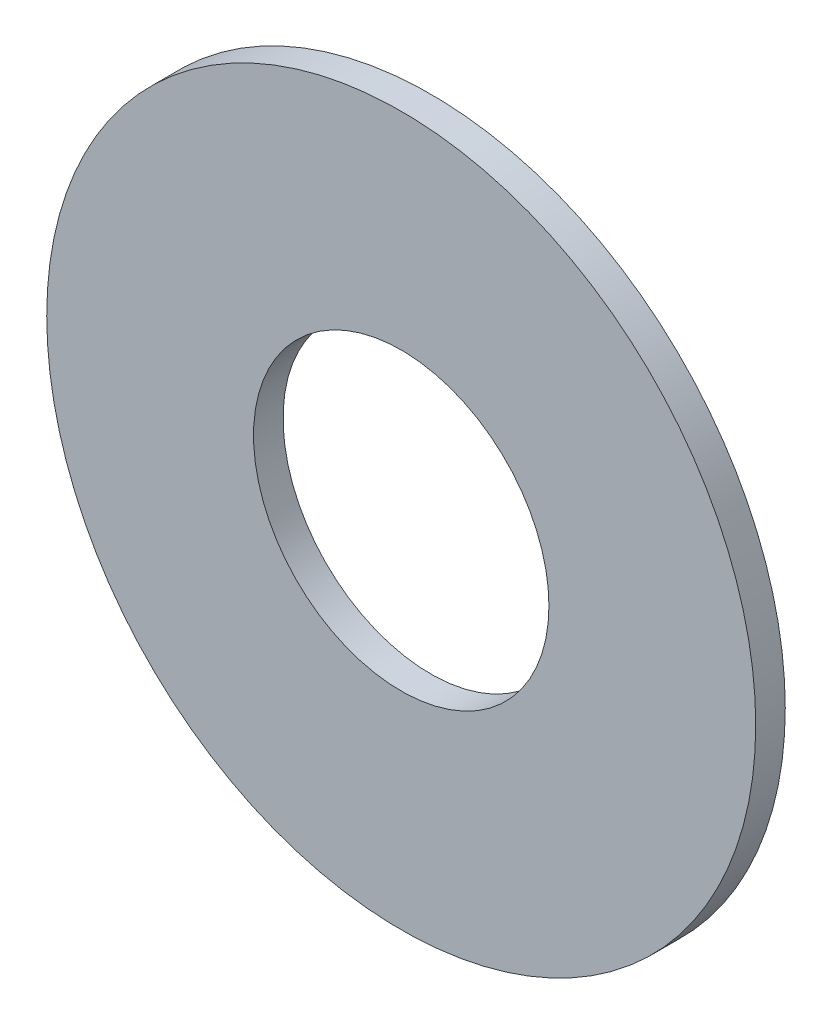
from build123d import *

# Parameters (mm, degrees)
ESBO_O1_R                = 6
RESSALTO_EXTRUS_O1_DEPTH = 0.5
ESBO_O2_R                = 2.5
CORTE_EXTRUS_O1_DEPTH    = 9.5


with BuildPart() as part:
    # Esboço1 → Ressalto-extrusão1 (new body)
    with BuildSketch(Plane.XY):
        Circle(ESBO_O1_R)
    extrude(amount=RESSALTO_EXTRUS_O1_DEPTH)

    # Esboço2 → Corte-extrusão1 (cut, through all)
    with BuildSketch(Plane.XY.offset(0.5)):
        Circle(ESBO_O2_R)
    extrude(amount=-CORTE_EXTRUS_O1_DEPTH, mode=Mode.SUBTRACT)


solid = part.part
